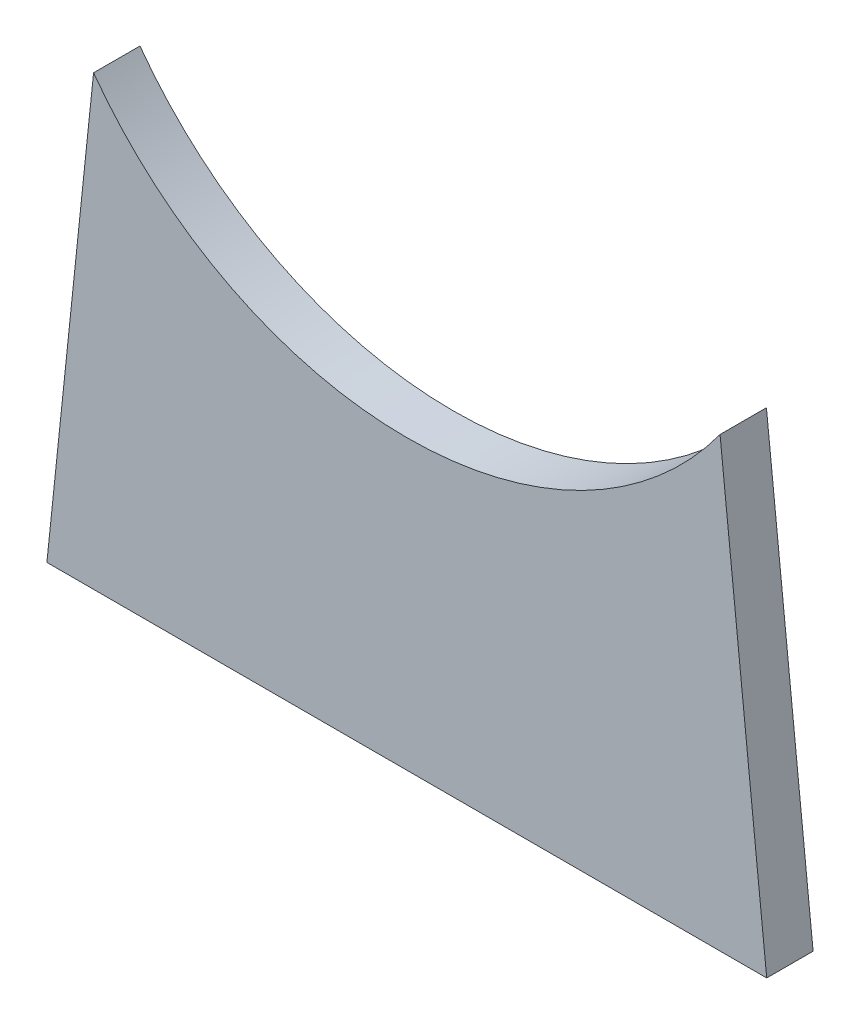
from build123d import *

# Parameters (mm, degrees)
BOSS_EXTRUDE1_DEPTH = 127.5


with BuildPart() as part:
    # Sketch1 → Boss-Extrude1 (new, symmetric)
    with BuildSketch(Plane.XY):
        with BuildLine():
            Line((-1978.125, 0), (1978.125, 0))
            Line((1978.125, 0), (1721.625, 2458.75))
            ThreePointArc((1721.625, 2458.75), (0, 1582.922445587), (-1721.625, 2458.75))
            Line((-1721.625, 2458.75), (-1978.125, 0))
        make_face()
    extrude(amount=BOSS_EXTRUDE1_DEPTH, both=True)


solid = part.part
